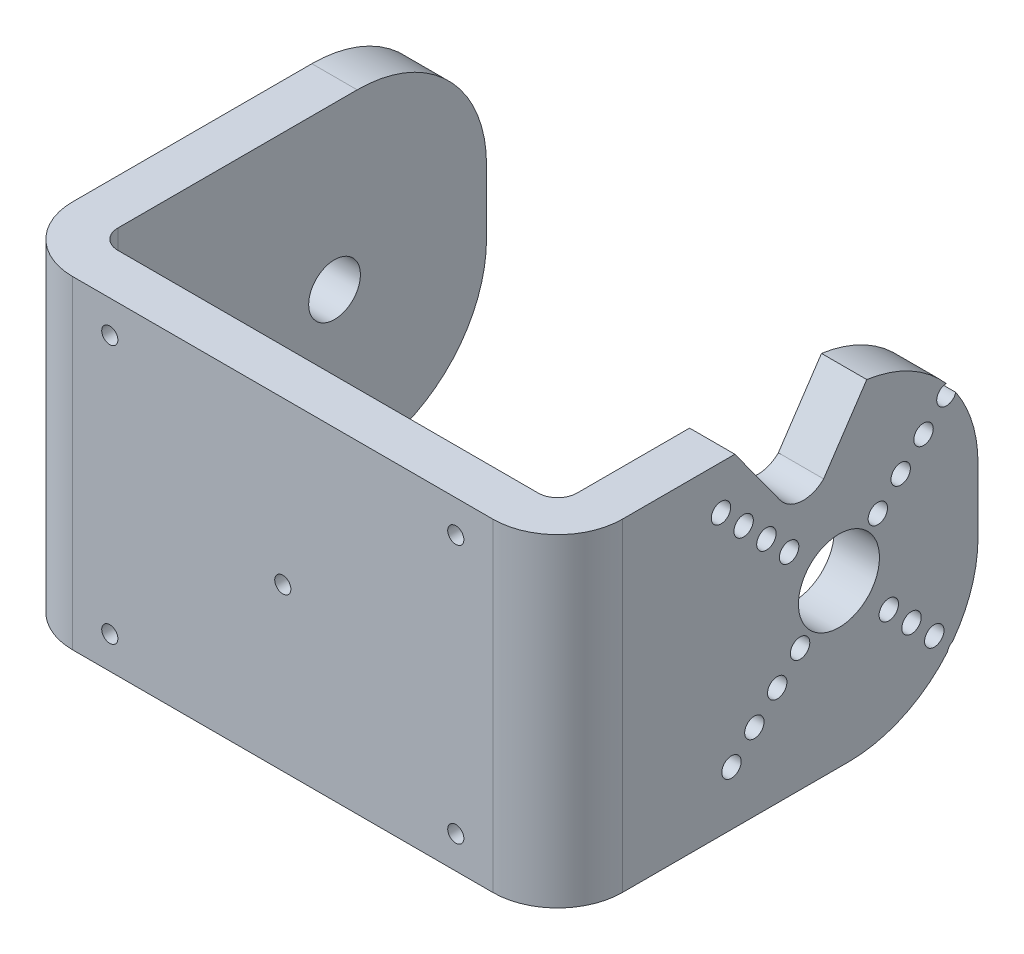
from build123d import *

# Parameters (mm, degrees)
BOSS_EXTRUDE1_DEPTH     = 50
FILLET2_R               = 20
SKETCH6_R               = 1.5
CUT_EXTRUDE2_DEPTH      = 28.4
CUT_EXTRUDE3_DEPTH      = 136.4
CUT_EXTRUDE4_DEPTH      = 120.503043838
CUT_EXTRUDE4_DEPTH_BACK = 26.4
SKETCH8_R               = 1.25
CUT_EXTRUDE5_DEPTH      = 100


with BuildPart() as part:
    # Sketch1 → Boss-Extrude1 (new body)
    with BuildSketch(Plane(origin=(0, 0, 0), x_dir=(1, 0, 0), z_dir=(0, 1, 0))):
        with BuildLine():
            Line((-56.375697839, 67.497981352), (-56.375697839, 10.497981352))
            ThreePointArc((-56.375697839, 10.497981352), (-53.44676565, 3.42691354), (-46.375697839, 0.497981352))
            Line((-46.375697839, 0.497981352), (18.624302161, 0.497981352))
            ThreePointArc((18.624302161, 0.497981352), (25.695369973, 3.42691354), (28.624302161, 10.497981352))
            Line((28.624302161, 10.497981352), (28.624302161, 65.497981352))
            Line((28.624302161, 65.497981352), (21.624302161, 65.497981352))
            Line((21.624302161, 65.497981352), (21.624302161, 10.497981352))
            ThreePointArc((21.624302161, 10.497981352), (20.745622505, 8.376661008), (18.624302161, 7.497981352))
            Line((18.624302161, 7.497981352), (-46.375697839, 7.497981352))
            ThreePointArc((-46.375697839, 7.497981352), (-48.497018182, 8.376661008), (-49.375697839, 10.497981352))
            Line((-49.375697839, 10.497981352), (-49.375697839, 67.497981352))
            Line((-49.375697839, 67.497981352), (-56.375697839, 67.497981352))
        make_face()
    extrude(amount=BOSS_EXTRUDE1_DEPTH)

    # Fillet2
    fillet2_edges = [part.edges().sort_by_distance(p)[0] for p in [
        (25.124302161, 0, -65.497981352),
        (-52.875697839, 0, -67.497981352),
        (25.124302161, 50, -65.497981352),
        (-52.875697839, 50, -67.497981352),
    ]]
    fillet(fillet2_edges, radius=FILLET2_R)

    # Sketch6 → Cut-Extrude2 (cut)
    with BuildSketch(Plane(origin=(28.624302161, 0, 0), x_dir=(0, 0, -1), z_dir=(1, 0, 0))):
        with BuildLine():
            ThreePointArc((39.997981352, 25), (43.997981352, 21), (47.997981352, 25))
            Line((47.997981352, 25), (39.997981352, 25))
        make_face()
        with BuildLine():
            Line((39.997981352, 25), (47.997981352, 25))
            ThreePointArc((47.997981352, 25), (43.997981352, 29), (39.997981352, 25))
        make_face()
        with BuildLine():
            ThreePointArc((37.736343923, 25), (43.997981352, 18.738362572), (50.25961878, 25))
            Line((50.25961878, 25), (47.997981352, 25))
            ThreePointArc((47.997981352, 25), (43.997981352, 21), (39.997981352, 25))
            Line((39.997981352, 25), (37.736343923, 25))
        make_face()
        with BuildLine():
            Line((47.997981352, 25), (50.25961878, 25))
            ThreePointArc((50.25961878, 25), (43.997981352, 31.261637428), (37.736343923, 25))
            Line((37.736343923, 25), (39.997981352, 25))
            ThreePointArc((39.997981352, 25), (43.997981352, 29), (47.997981352, 25))
        make_face()
        with Locations((36.290517437, 32.707463915)):
            Circle(SKETCH6_R)
        with Locations((32.776196734, 36.221784617)):
            Circle(SKETCH6_R)
        with Locations((29.254804964, 39.743176388)):
            Circle(SKETCH6_R)
        with Locations((25.754626397, 43.243354955)):
            Circle(SKETCH6_R)
        with Locations((50.008388992, 31.01040764)):
            Circle(SKETCH6_R)
        with Locations((53.543922898, 34.545941546)):
            Circle(SKETCH6_R)
        with Locations((57.079456803, 38.081475452)):
            Circle(SKETCH6_R)
        with Locations((60.614990709, 41.617009358)):
            Circle(SKETCH6_R)
        with Locations((51.705445266, 17.292536085)):
            Circle(SKETCH6_R)
        with Locations((55.219765969, 13.778215383)):
            Circle(SKETCH6_R)
        with Locations((58.741157739, 10.256823612)):
            Circle(SKETCH6_R)
        with Locations((62.241336306, 6.756645045)):
            Circle(SKETCH6_R)
        with Locations((37.987573711, 18.98959236)):
            Circle(SKETCH6_R)
        with Locations((34.452039805, 15.454058454)):
            Circle(SKETCH6_R)
        with Locations((30.9165059, 11.918524548)):
            Circle(SKETCH6_R)
        with Locations((27.380971994, 8.382990642)):
            Circle(SKETCH6_R)
    extrude(amount=-CUT_EXTRUDE2_DEPTH, mode=Mode.SUBTRACT)

    # Sketch6<3> → Cut-Extrude3 (cut)
    with BuildSketch(Plane(origin=(28.624302161, 0, 0), x_dir=(0, 0, -1), z_dir=(1, 0, 0))):
        with BuildLine():
            ThreePointArc((39.997981352, 25), (43.997981352, 21), (47.997981352, 25))
            Line((47.997981352, 25), (39.997981352, 25))
        make_face()
        with BuildLine():
            Line((39.997981352, 25), (47.997981352, 25))
            ThreePointArc((47.997981352, 25), (43.997981352, 29), (39.997981352, 25))
        make_face()
    extrude(amount=-CUT_EXTRUDE3_DEPTH, mode=Mode.SUBTRACT)

    # Sketch7 → Cut-Extrude4 (cut, two sides: drawn at the far end of the back side and taken through both)
    with BuildSketch(Plane(origin=(28.624302161, 0, 0), x_dir=(0, 0, -1), z_dir=(1, 0, 0)).offset(-CUT_EXTRUDE4_DEPTH_BACK)):
        with BuildLine():
            Line((-59.021683843, 169.857328721), (27.901409821, 50))
            Line((27.901409821, 50), (34.889942889, 40.363586132))
            ThreePointArc((34.889942889, 40.363586132), (38.136702541, 38.542544558), (41.629478365, 39.830239282))
            Line((41.629478365, 39.830239282), (48.296449702, 49.803246574))
            Line((48.296449702, 49.803246574), (130.580983454, 172.89125966))
            Line((130.580983454, 172.89125966), (125.843258674, 468.970924285))
            Line((125.843258674, 468.970924285), (-63.759408622, 465.936993346))
            Line((-63.759408622, 465.936993346), (-59.021683843, 169.857328721))
        make_face()
    extrude(amount=CUT_EXTRUDE4_DEPTH + CUT_EXTRUDE4_DEPTH_BACK, mode=Mode.SUBTRACT)

    # Sketch8 → Cut-Extrude5 (cut)
    with BuildSketch(Plane.XY.offset(-0.497981352)):
        with Locations((-40.625697839, 45)):
            Circle(SKETCH8_R)
        with Locations((12.874302161, 45)):
            Circle(SKETCH8_R)
        with Locations((-13.875697839, 25)):
            Circle(SKETCH8_R)
        with Locations((-40.625697839, 5)):
            Circle(SKETCH8_R)
        with Locations((12.874302161, 5)):
            Circle(SKETCH8_R)
    extrude(amount=-CUT_EXTRUDE5_DEPTH, mode=Mode.SUBTRACT)


solid = part.part
